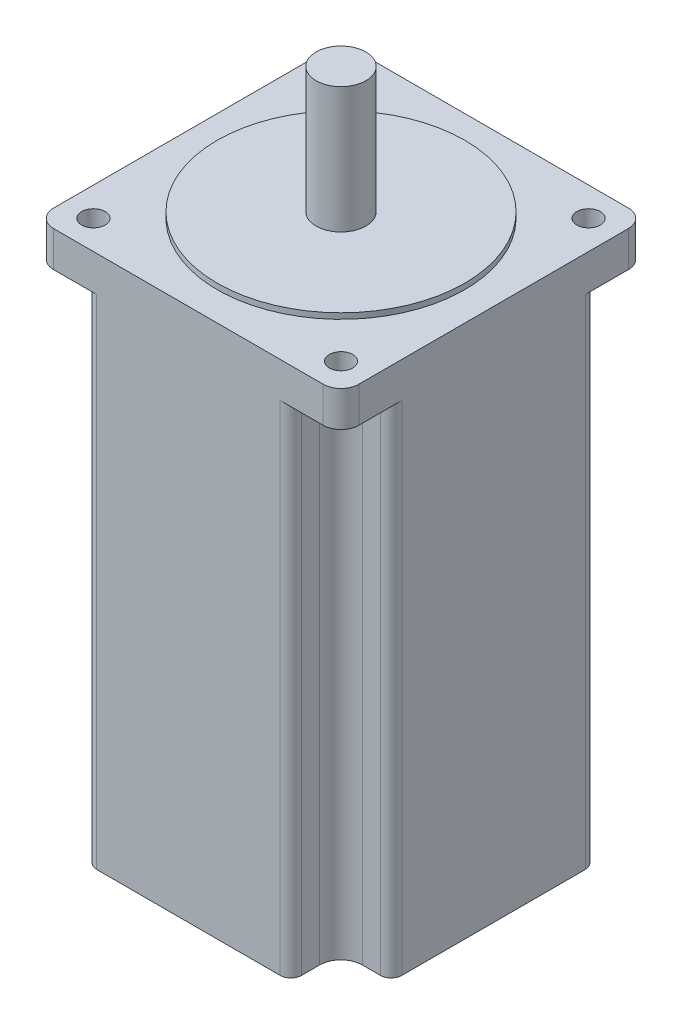
from build123d import *

# Parameters (mm, degrees)
SKETCH1_W           = 85.8
SKETCH1_H           = 85.8
SKETCH1_R           = 3.3
BOSS_EXTRUDE1_DEPTH = 150
SKETCH2_R           = 34.8
BOSS_EXTRUDE2_DEPTH = 1.6
SKETCH3_R           = 7
BOSS_EXTRUDE3_DEPTH = 37
CUT_EXTRUDE1_START  = -10
CUT_EXTRUDE1_DEPTH  = 157
FILLET1_R           = 5
FILLET2_R           = 3


with BuildPart() as part:
    # Sketch1 → Boss-Extrude1 (new body)
    with BuildSketch(Plane(origin=(0, 0, 0), x_dir=(1, 0, 0), z_dir=(0, 1, 0))):
        Rectangle(SKETCH1_W, SKETCH1_H)
        with Locations(Location((-34.8, 34.8, 0), (0, 0, 270))):
            Circle(SKETCH1_R, mode=Mode.SUBTRACT)
        with Locations(Location((34.8, 34.8, 0), (0, 0, 270))):
            Circle(SKETCH1_R, mode=Mode.SUBTRACT)
        with Locations(Location((34.8, -34.8, 0), (0, 0, 270))):
            Circle(SKETCH1_R, mode=Mode.SUBTRACT)
        with Locations(Location((-34.8, -34.8, 0), (0, 0, 270))):
            Circle(SKETCH1_R, mode=Mode.SUBTRACT)
    extrude(amount=-BOSS_EXTRUDE1_DEPTH)

    # Sketch2 → Boss-Extrude2 (add)
    with BuildSketch(Plane(origin=(0, 0, 0), x_dir=(1, 0, 0), z_dir=(0, 1, 0))):
        with Locations(Location((0, 0, 0), (0, 0, 90))):
            Circle(SKETCH2_R)
    extrude(amount=BOSS_EXTRUDE2_DEPTH)

    # Sketch3 → Boss-Extrude3 (add)
    with BuildSketch(Plane(origin=(0, 0, 0), x_dir=(1, 0, 0), z_dir=(0, 1, 0))):
        with Locations(Location((0, 0, 0), (0, 0, 270))):
            Circle(SKETCH3_R)
    extrude(amount=BOSS_EXTRUDE3_DEPTH)

    # Sketch4 → Cut-Extrude1 (cut)
    with BuildSketch(Plane(origin=(0, 0, 0), x_dir=(1, 0, 0), z_dir=(0, 1, 0)).offset(CUT_EXTRUDE1_START)):
        with BuildLine():
            Line((-34.8, 28.8), (-51.295140444, 28.8))
            Line((-51.295140444, 28.8), (-51.295140444, 48.66224904))
            Line((-51.295140444, 48.66224904), (-28.8, 48.66224904))
            Line((-28.8, 48.66224904), (-28.8, 34.8))
            ThreePointArc((-28.8, 34.8), (-30.557359313, 30.557359313), (-34.8, 28.8))
        make_face()
        with BuildLine():
            Line((48.66224904, 28.8), (34.8, 28.8))
            ThreePointArc((34.8, 28.8), (30.557359313, 30.557359313), (28.8, 34.8))
            Line((28.8, 34.8), (28.8, 51.295140444))
            Line((28.8, 51.295140444), (48.66224904, 51.295140444))
            Line((48.66224904, 51.295140444), (48.66224904, 28.8))
        make_face()
        with BuildLine():
            Line((28.8, -48.66224904), (28.8, -34.8))
            ThreePointArc((28.8, -34.8), (30.557359313, -30.557359313), (34.8, -28.8))
            Line((34.8, -28.8), (51.295140444, -28.8))
            Line((51.295140444, -28.8), (51.295140444, -48.66224904))
            Line((51.295140444, -48.66224904), (28.8, -48.66224904))
        make_face()
        with BuildLine():
            Line((-48.66224904, -28.8), (-34.8, -28.8))
            ThreePointArc((-34.8, -28.8), (-30.557359313, -30.557359313), (-28.8, -34.8))
            Line((-28.8, -34.8), (-28.8, -51.295140444))
            Line((-28.8, -51.295140444), (-48.66224904, -51.295140444))
            Line((-48.66224904, -51.295140444), (-48.66224904, -28.8))
        make_face()
    extrude(amount=-CUT_EXTRUDE1_DEPTH, mode=Mode.SUBTRACT)

    # Fillet1
    fillet1_edges = [part.edges().sort_by_distance(p)[0] for p in [
        (42.9, -5, -42.9),
        (-42.9, -5, -42.9),
        (-42.9, -5, 42.9),
        (42.9, -5, 42.9),
    ]]
    fillet(fillet1_edges, radius=FILLET1_R)

    # Fillet2
    fillet2_edges = [part.edges().sort_by_distance(p)[0] for p in [
        (-28.8, -80, 42.9),
        (-42.9, -80, 28.8),
        (42.9, -80, 28.8),
        (28.8, -80, 42.9),
        (28.8, -80, -42.9),
        (42.9, -80, -28.8),
        (-42.9, -80, -28.8),
        (-28.8, -80, -42.9),
    ]]
    fillet(fillet2_edges, radius=FILLET2_R)


solid = part.part
